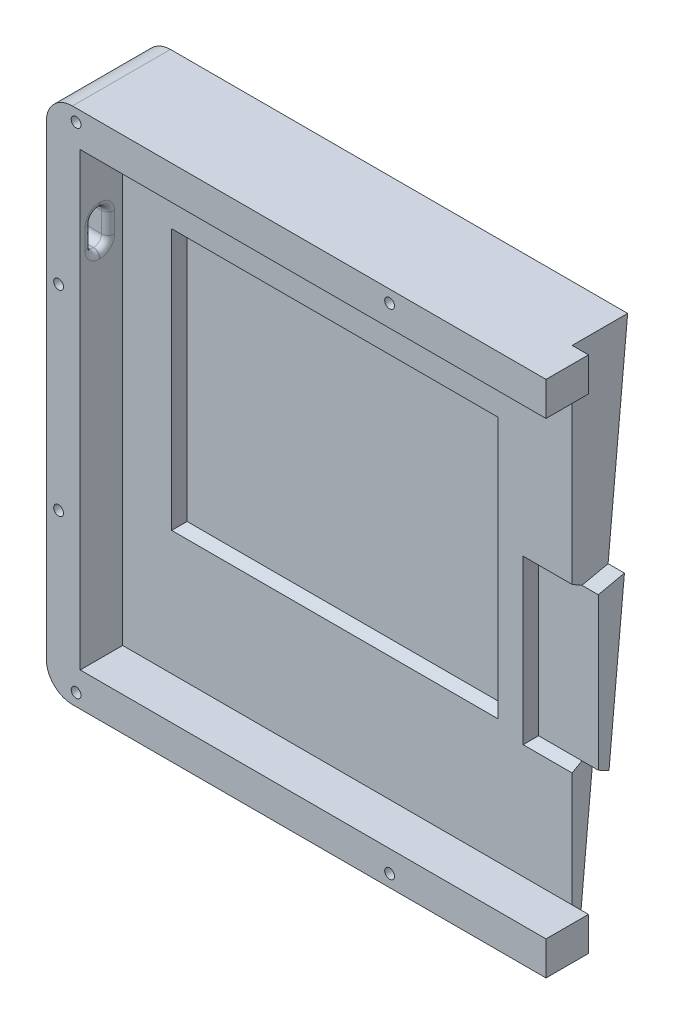
from build123d import *

# Parameters (mm, degrees)
EXTRUDE_1_DEPTH      = 30
SKETCH_2_R           = 1.5
CUT_EXTRUDE_1_DEPTH  = 5
CUT_EXTRUDE_4_DEPTH  = 307
SKETCH_3_W           = 285.26
SKETCH_3_H           = 138.01
CUT_EXTRUDE_5_DEPTH  = 13
SKETCH_12_W          = 40
SKETCH_12_H          = 50
CUT_EXTRUDE_7_DEPTH  = 3
CUT_EXTRUDE_7_DRAFT  = -30
SKETCH_9_W           = 100
SKETCH_9_H           = 80
CUT_EXTRUDE_8_DEPTH  = 3
CUT_EXTRUDE_8_DRAFT  = -30
CUT_EXTRUDE_9_DEPTH  = 11
FILLET_1_R           = 2
CUT_EXTRUDE_10_DEPTH = 11
FILLET_2_R           = 2
FILLET_3_R           = 2
FILLET_4_R           = 2
CUT_EXTRUDE_11_DEPTH = 5


with BuildPart() as part:
    # Model → 凸台-拉伸1 (new body)
    with BuildSketch(Plane.XY):
        with BuildLine():
            Line((0, 11), (0, 150.75))
            ThreePointArc((0, 150.75), (2.343145751, 156.406854249), (8, 158.75))
            Line((8, 158.75), (298.011203897, 158.75))
            ThreePointArc((298.011203897, 158.75), (303.664092807, 156.410816811), (306.011196041, 150.761211743))
            Line((306.011196041, 150.761211743), (306.207051361, 11.011211743))
            Line((306.207051361, 11.011211743), (306.207051361, 8))
            ThreePointArc((306.207051361, 8), (303.863905611, 2.343145751), (298.207051361, 0))
            Line((298.207051361, 0), (8, 0))
            ThreePointArc((8, 0), (2.343145751, 2.343145751), (0, 8))
            Line((0, 8), (0, 11))
        make_face()
    extrude(amount=-EXTRUDE_1_DEPTH)

    # 草图2 → 切除-拉伸1 (cut)
    with BuildSketch(Plane.XY):
        with Locations((105.108569936, 3.75)):
            Circle(SKETCH_2_R)
        with Locations((9.108569936, 3.75)):
            Circle(SKETCH_2_R)
        with Locations((201.10846029, 3.817270412)):
            Circle(SKETCH_2_R)
        with Locations((297.108366012, 3.951811323)):
            Circle(SKETCH_2_R)
        with Locations((105.108569936, 155)):
            Circle(SKETCH_2_R)
        with Locations((9.108569936, 155)):
            Circle(SKETCH_2_R)
        with Locations((201.10846029, 154.932729588)):
            Circle(SKETCH_2_R)
        with Locations((297.108366012, 154.798188677)):
            Circle(SKETCH_2_R)
        with Locations((3.75, 109.375)):
            Circle(SKETCH_2_R)
        with Locations((3.75, 49.375)):
            Circle(SKETCH_2_R)
        with Locations((302.318900647, 109.584217456)):
            Circle(SKETCH_2_R)
        with Locations((302.402988717, 49.58427638)):
            Circle(SKETCH_2_R)
    extrude(amount=-CUT_EXTRUDE_1_DEPTH, mode=Mode.SUBTRACT)

    # 草图6 → 切除-拉伸4 (cut)
    with BuildSketch(Plane.ZY):
        Polygon((-30, 158.75), (-30, 0), (-15, 0), align=None)
    extrude(amount=-CUT_EXTRUDE_4_DEPTH, mode=Mode.SUBTRACT)

    # 草图3 → 切除-拉伸5 (cut)
    with BuildSketch(Plane.XY):
        with Locations((153, 79.375)):
            Rectangle(SKETCH_3_W, SKETCH_3_H)
    extrude(amount=-CUT_EXTRUDE_5_DEPTH, mode=Mode.SUBTRACT)


with BuildPart() as cut_extrude_7_tool:
    # 草图12 → 切除-拉伸7 (with draft: the straight prism first)
    with BuildSketch(Plane.XY.offset(-13)):
        with Locations((153, 70.37)):
            Rectangle(SKETCH_12_W, SKETCH_12_H)
    extrude(amount=-CUT_EXTRUDE_7_DEPTH)
    # 切除-拉伸7: the draft: its side faces are tilted about the plane it starts from
    cut_extrude_7_sides = [cut_extrude_7_tool.faces().sort_by_distance(p)[0] for p in [
        (153, 45.37, -14.5),
        (173, 70.37, -14.5),
        (153, 95.37, -14.5),
        (133, 70.37, -14.5),
    ]]
    draft(cut_extrude_7_sides, Plane.XY.offset(-13), CUT_EXTRUDE_7_DRAFT)


with BuildPart() as part_1:
    add(part.part)

    # 切除-拉伸7: cut by cut_extrude_7_tool
    add(cut_extrude_7_tool.part, mode=Mode.SUBTRACT)


with BuildPart() as cut_extrude_8_tool:
    # 草图9 → 切除-拉伸8 (with draft: the straight prism first)
    with BuildSketch(Plane.XY.offset(-13)):
        with Locations((75.37, 88.38)):
            Rectangle(SKETCH_9_W, SKETCH_9_H)
    extrude(amount=-CUT_EXTRUDE_8_DEPTH)
    # 切除-拉伸8: the draft: its side faces are tilted about the plane it starts from
    cut_extrude_8_sides = [cut_extrude_8_tool.faces().sort_by_distance(p)[0] for p in [
        (25.37, 88.38, -14.5),
        (75.37, 48.38, -14.5),
        (125.37, 88.38, -14.5),
        (75.37, 128.38, -14.5),
    ]]
    draft(cut_extrude_8_sides, Plane.XY.offset(-13), CUT_EXTRUDE_8_DRAFT)


with BuildPart() as part_2:
    add(part_1.part)

    # 切除-拉伸8: cut by cut_extrude_8_tool
    add(cut_extrude_8_tool.part, mode=Mode.SUBTRACT)

    # 草图14 → 切除-拉伸9 (cut)
    with BuildSketch(Plane.ZY):
        with BuildLine():
            Line((-5.9, 129.38), (-6.1, 129.38))
            ThreePointArc((-6.1, 129.38), (-7.797056275, 128.677056275), (-8.5, 126.98))
            Line((-8.5, 126.98), (-8.5, 120.78))
            ThreePointArc((-8.5, 120.78), (-7.797056275, 119.082943725), (-6.1, 118.38))
            Line((-6.1, 118.38), (-5.9, 118.38))
            ThreePointArc((-5.9, 118.38), (-4.202943725, 119.082943725), (-3.5, 120.78))
            Line((-3.5, 120.78), (-3.5, 126.98))
            ThreePointArc((-3.5, 126.98), (-4.202943725, 128.677056275), (-5.9, 129.38))
        make_face()
    extrude(amount=-CUT_EXTRUDE_9_DEPTH, mode=Mode.SUBTRACT)

    # 圆角1
    fillet_1_edges = [part_2.edges().sort_by_distance(p)[0] for p in [
        (0, 123.88, -3.5),
        (0, 118.38, -6),
        (0, 119.082943725, -7.797056275),
        (0, 128.677056275, -7.797056275),
        (0, 128.677056275, -4.202943725),
        (0, 129.38, -6),
        (0, 123.88, -8.5),
        (0, 119.082943725, -4.202943725),
    ]]
    fillet(fillet_1_edges, radius=FILLET_1_R)

    # 草图15 → 切除-拉伸10 (cut)
    with BuildSketch(Plane.XZ):
        with BuildLine():
            Line((222.53, -3.959687417), (229.73, -3.959687417))
            ThreePointArc((229.73, -3.959687417), (231.427056275, -4.662631142), (232.13, -6.359687417))
            Line((232.13, -6.359687417), (232.13, -6.559687417))
            ThreePointArc((232.13, -6.559687417), (231.427056275, -8.256743692), (229.73, -8.959687417))
            Line((229.73, -8.959687417), (222.53, -8.959687417))
            ThreePointArc((222.53, -8.959687417), (220.832943725, -8.256743692), (220.13, -6.559687417))
            Line((220.13, -6.559687417), (220.13, -6.359687417))
            ThreePointArc((220.13, -6.359687417), (220.832943725, -4.662631142), (222.53, -3.959687417))
        make_face()
    extrude(amount=-CUT_EXTRUDE_10_DEPTH, mode=Mode.SUBTRACT)

    # 圆角2
    fillet_2_edges = [part_2.edges().sort_by_distance(p)[0] for p in [
        (226.13, 0, -3.959687417),
        (232.13, 0, -6.459687417),
        (231.427056275, 0, -8.256743692),
        (220.832943725, 0, -4.662631142),
        (220.13, 0, -6.459687417),
        (220.832943725, 0, -8.256743692),
        (226.13, 0, -8.959687417),
        (231.427056275, 0, -4.662631142),
    ]]
    fillet(fillet_2_edges, radius=FILLET_2_R)

    # 圆角3
    fillet_3_edges = [part_2.edges().sort_by_distance(p)[0] for p in [
        (10.37, 129.38, -6),
        (10.37, 128.677056275, -7.797056275),
        (10.37, 123.88, -8.5),
        (10.37, 119.082943725, -7.797056275),
        (10.37, 118.38, -6),
        (10.37, 119.082943725, -4.202943725),
        (10.37, 123.88, -3.5),
        (10.37, 128.677056275, -4.202943725),
    ]]
    fillet(fillet_3_edges, radius=FILLET_3_R)

    # 圆角4
    fillet_4_edges = [part_2.edges().sort_by_distance(p)[0] for p in [
        (220.13, 10.37, -6.459687417),
        (220.832943725, 10.37, -8.256743692),
        (226.13, 10.37, -8.959687417),
        (231.427056275, 10.37, -8.256743692),
        (232.13, 10.37, -6.459687417),
        (231.427056275, 10.37, -4.662631142),
        (226.13, 10.37, -3.959687417),
        (220.832943725, 10.37, -4.662631142),
    ]]
    fillet(fillet_4_edges, radius=FILLET_4_R)


with BuildPart() as body_2:
    # Split Bodies 1: the piece on the far side of the plane
    add(part_2.part)
    split(bisect_by=Plane(origin=(153.005601949, 0, 0), x_dir=(0, 0, 1), z_dir=(1, 0, 0)), keep=Keep.BOTTOM)

    # 草图19 → 切除-拉伸11 (cut)
    with BuildSketch(Plane(origin=(153.005601949, 0, 0), x_dir=(0, 0, -1), z_dir=(1, 0, 0))):
        Polygon((13, 148.38), (13, 95.37), (16, 93.637949192), (24.011338583, 95.37), (30, 158.75), (13, 158.75), align=None)
        Polygon((19.286929134, 45.37), (15, 0), (13, 0), (13, 45.37), (16, 47.102050808), align=None)
    extrude(amount=-CUT_EXTRUDE_11_DEPTH, mode=Mode.SUBTRACT)


with BuildPart() as part_3:
    add(part_2.part)

    # Split Bodies 1
    split(bisect_by=Plane(origin=(153.005601949, 0, 0), x_dir=(0, 0, 1), z_dir=(1, 0, 0)), keep=Keep.TOP)


solid = body_2.part
